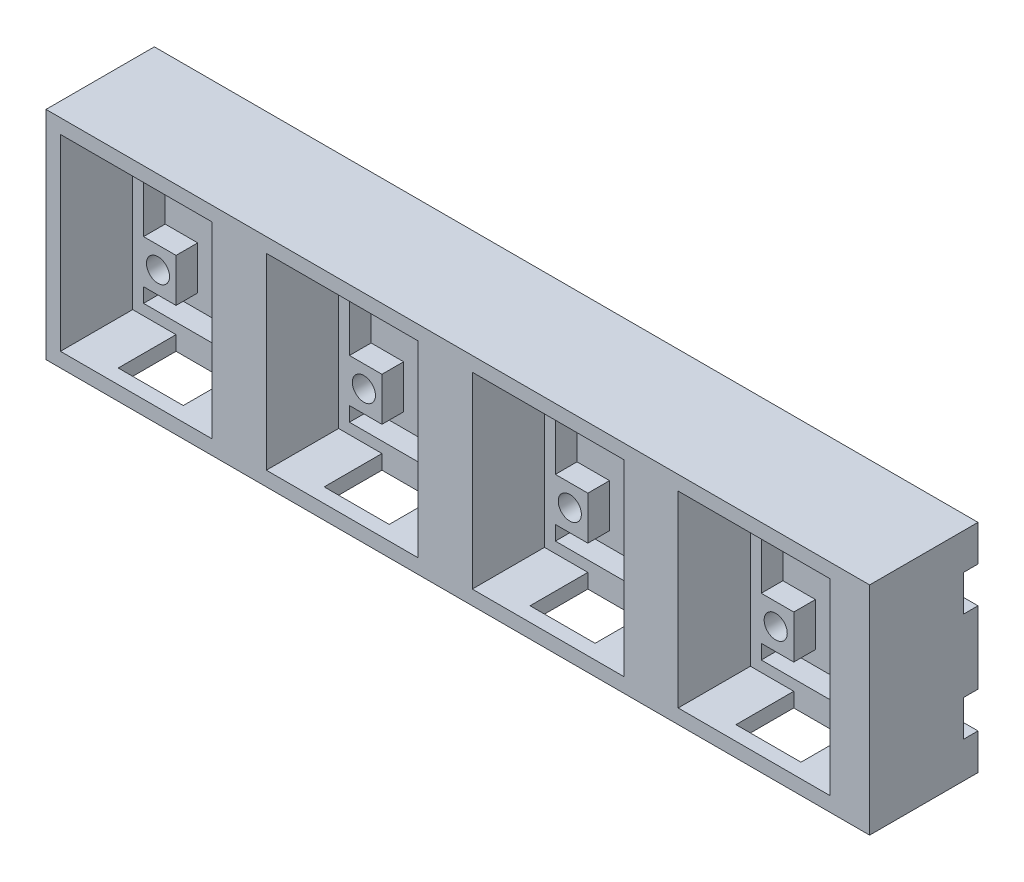
from build123d import *

# Parameters (mm, degrees)
SKETCH_1_W          = 114
SKETCH_1_H          = 30
EXTRUDE_1_DEPTH     = 15
SKETCH_2_W          = 21
SKETCH_2_H          = 26
CUT_EXTRUDE_1_DEPTH = 13
SKETCH_3_W          = 21
SKETCH_3_H          = 26
SKETCH_3_W_2        = 18
SKETCH_3_H_2        = 23
EXTRUDE_2_DEPTH     = 3
SKETCH_5_W          = 4.5
SKETCH_5_H          = 6
EXTRUDE_3_DEPTH     = 3
SKETCH_6_R          = 1.6
CUT_EXTRUDE_2_DEPTH = 94.778887913
SKETCH_7_W          = 9
SKETCH_7_H          = 8
CUT_EXTRUDE_3_DEPTH = 90.714734825
SKETCH_12_W         = 2
SKETCH_12_H         = 5
CUT_EXTRUDE_4_DEPTH = 3.5


with BuildPart() as part:
    # ｽｹｯﾁ1 → ﾎﾞｽ - 押し出し1 (new body)
    with BuildSketch(Plane.XY):
        with Locations((-26.90312059, 25.678571429)):
            Rectangle(SKETCH_1_W, SKETCH_1_H)
    extrude(amount=EXTRUDE_1_DEPTH)

    # ｽｹｯﾁ2 → ｶｯﾄ - 押し出し1 (cut)
    with BuildSketch(Plane.XY.offset(15)):
        with Locations((-71.40312059, 25.678571429)):
            Rectangle(SKETCH_2_W, SKETCH_2_H)
        with Locations((-42.90312059, 25.678571429)):
            Rectangle(SKETCH_2_W, SKETCH_2_H)
        with Locations((-14.40312059, 25.678571429)):
            Rectangle(SKETCH_2_W, SKETCH_2_H)
        with Locations((14.09687941, 25.678571429)):
            Rectangle(SKETCH_2_W, SKETCH_2_H)
    extrude(amount=-CUT_EXTRUDE_1_DEPTH, mode=Mode.SUBTRACT)

    # ｽｹｯﾁ3 → ﾎﾞｽ - 押し出し2 (add)
    # profile 1 of 4: a face of its own
    with BuildSketch(Plane.XY.offset(2)):
        with Locations((-71.40312059, 25.678571429)):
            Rectangle(SKETCH_3_W, SKETCH_3_H)
        with Locations((-71.40312059, 25.678571429)):
            Rectangle(SKETCH_3_W_2, SKETCH_3_H_2, mode=Mode.SUBTRACT)
    # profile 2 of 4: a face of its own
    with BuildSketch(Plane.XY.offset(2)):
        with Locations((-42.90312059, 25.678571429)):
            Rectangle(SKETCH_3_W, SKETCH_3_H)
        with Locations((-42.90312059, 25.678571429)):
            Rectangle(SKETCH_3_W_2, SKETCH_3_H_2, mode=Mode.SUBTRACT)
    # profile 3 of 4: a face of its own
    with BuildSketch(Plane.XY.offset(2)):
        with Locations((-14.40312059, 25.678571429)):
            Rectangle(SKETCH_3_W, SKETCH_3_H)
        with Locations((-14.40312059, 25.678571429)):
            Rectangle(SKETCH_3_W_2, SKETCH_3_H_2, mode=Mode.SUBTRACT)
    # profile 4 of 4: a face of its own
    with BuildSketch(Plane.XY.offset(2)):
        with Locations((14.09687941, 25.678571429)):
            Rectangle(SKETCH_3_W, SKETCH_3_H)
        with Locations((14.09687941, 25.678571429)):
            Rectangle(SKETCH_3_W_2, SKETCH_3_H_2, mode=Mode.SUBTRACT)
    extrude(amount=EXTRUDE_2_DEPTH)

    # ｽｹｯﾁ5 → ﾎﾞｽ - 押し出し3 (add)
    with BuildSketch(Plane.XY.offset(2)):
        with Locations((-64.65312059, 19.178571429)):
            Rectangle(SKETCH_5_W, SKETCH_5_H)
        with Locations((-78.15312059, 19.178571429)):
            Rectangle(SKETCH_5_W, SKETCH_5_H)
        with Locations((-49.65312059, 19.178571429)):
            Rectangle(SKETCH_5_W, SKETCH_5_H)
        with Locations((-36.15312059, 19.178571429)):
            Rectangle(SKETCH_5_W, SKETCH_5_H)
        with Locations((-21.15312059, 19.178571429)):
            Rectangle(SKETCH_5_W, SKETCH_5_H)
        with Locations((-7.65312059, 19.178571429)):
            Rectangle(SKETCH_5_W, SKETCH_5_H)
        with Locations((7.34687941, 19.178571429)):
            Rectangle(SKETCH_5_W, SKETCH_5_H)
        with Locations((20.84687941, 19.178571429)):
            Rectangle(SKETCH_5_W, SKETCH_5_H)
    extrude(amount=EXTRUDE_3_DEPTH)

    # ｽｹｯﾁ6 → ｶｯﾄ - 押し出し2 (cut, through all)
    with BuildSketch(Plane.XY.offset(5)):
        with Locations((-64.40312059, 19.178571429)):
            Circle(SKETCH_6_R)
        with Locations((-78.40312059, 19.178571429)):
            Circle(SKETCH_6_R)
        with Locations((-49.90312059, 19.178571429)):
            Circle(SKETCH_6_R)
        with Locations((-35.90312059, 19.178571429)):
            Circle(SKETCH_6_R)
        with Locations((-21.40312059, 19.178571429)):
            Circle(SKETCH_6_R)
        with Locations((-7.40312059, 19.178571429)):
            Circle(SKETCH_6_R)
        with Locations((7.09687941, 19.178571429)):
            Circle(SKETCH_6_R)
        with Locations((21.09687941, 19.178571429)):
            Circle(SKETCH_6_R)
    extrude(amount=-CUT_EXTRUDE_2_DEPTH, mode=Mode.SUBTRACT)

    # ｽｹｯﾁ7 → ｶｯﾄ - 押し出し3 (cut, through all)
    with BuildSketch(Plane(origin=(0, 12.678571429, 0), x_dir=(1, 0, 0), z_dir=(0, 1, 0))):
        with Locations((-71.40312059, -9)):
            Rectangle(SKETCH_7_W, SKETCH_7_H)
        with Locations((-42.90312059, -9)):
            Rectangle(SKETCH_7_W, SKETCH_7_H)
        with Locations((-14.40312059, -9)):
            Rectangle(SKETCH_7_W, SKETCH_7_H)
        with Locations((14.09687941, -9)):
            Rectangle(SKETCH_7_W, SKETCH_7_H)
    extrude(amount=-CUT_EXTRUDE_3_DEPTH, mode=Mode.SUBTRACT)

    # ｽｹｯﾁ12 → ｶｯﾄ - 押し出し4 (cut)
    with BuildSketch(Plane(origin=(30.09687941, 0, 0), x_dir=(0, 0, -1), z_dir=(1, 0, 0))):
        with Locations((-1, 18.178571429)):
            Rectangle(SKETCH_12_W, SKETCH_12_H)
        with Locations((-1, 33.178571429)):
            Rectangle(SKETCH_12_W, SKETCH_12_H)
    extrude(amount=-CUT_EXTRUDE_4_DEPTH, mode=Mode.SUBTRACT)


solid = part.part
